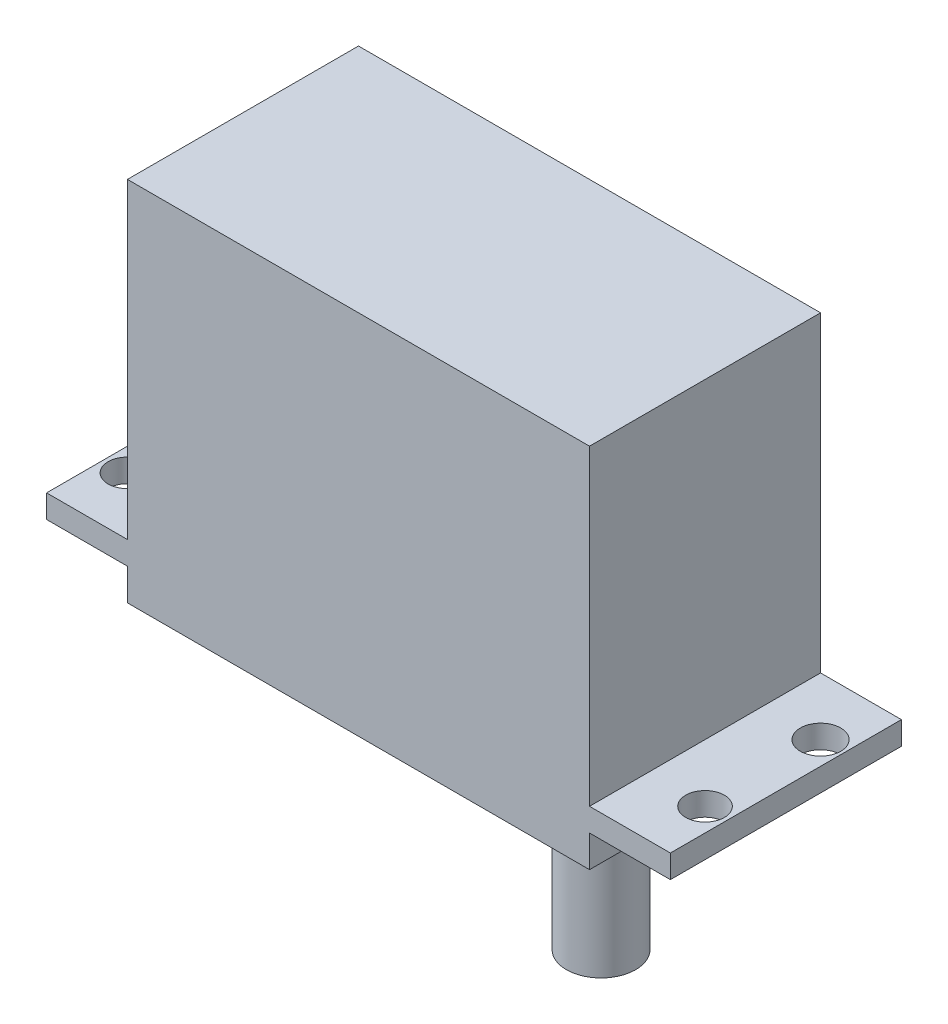
from build123d import *

# Parameters (mm, degrees)
SKETCH1_W           = 40
SKETCH1_H           = 20
BOSS_EXTRUDE1_DEPTH = 14
SKETCH2_W           = 54
SKETCH2_H           = 20
BOSS_EXTRUDE2_DEPTH = 1
SKETCH3_W           = 40
SKETCH3_H           = 20
BOSS_EXTRUDE3_DEPTH = 2.75
SKETCH4_R           = 3
BOSS_EXTRUDE4_DEPTH = 15.5
SKETCH5_R           = 1.673571511
SKETCH5_R_2         = 1.749374088
CUT_EXTRUDE3_DEPTH  = 9.5


with BuildPart() as part:
    # Sketch1 → Boss-Extrude1 (new, symmetric)
    with BuildSketch(Plane(origin=(0, 0, 0), x_dir=(1, 0, 0), z_dir=(0, 1, 0))):
        with Locations((2.196078431, 1.058823529)):
            Rectangle(SKETCH1_W, SKETCH1_H)
    extrude(amount=BOSS_EXTRUDE1_DEPTH, both=True)

    # Sketch2 → Boss-Extrude2 (add, symmetric)
    with BuildSketch(Plane.XZ.offset(14)):
        with Locations((2.196078431, -1.058823529)):
            Rectangle(SKETCH2_W, SKETCH2_H)
    extrude(amount=BOSS_EXTRUDE2_DEPTH, both=True)

    # Sketch3 → Boss-Extrude3 (add, symmetric)
    with BuildSketch(Plane.XZ.offset(15)):
        with Locations((2.196078431, -1.058823529)):
            Rectangle(SKETCH3_W, SKETCH3_H)
    extrude(amount=BOSS_EXTRUDE3_DEPTH, both=True)

    # Sketch4 → Boss-Extrude4 (add, symmetric)
    with BuildSketch(Plane.XZ.offset(17.75)):
        with Locations(Location((13.196078431, -1.058823529, 0), (0, 0, 270))):
            Circle(SKETCH4_R)
    extrude(amount=BOSS_EXTRUDE4_DEPTH, both=True)

    # Sketch5 → Cut-Extrude3 (cut)
    with BuildSketch(Plane.XZ.offset(15)):
        with Locations(Location((-22.803921569, 3.941176471, 0), (0, 0, 270))):
            Circle(SKETCH5_R)
        with Locations(Location((-22.803921569, -6.058823529, 0), (0, 0, 270))):
            Circle(SKETCH5_R_2)
    cut_extrude3 = extrude(amount=-CUT_EXTRUDE3_DEPTH, mode=Mode.SUBTRACT)

    # Mirror1: Cut-Extrude3 across plane
    add(cut_extrude3.mirror(Plane.ZY.offset(-2.196078431)), mode=Mode.SUBTRACT)


solid = part.part
